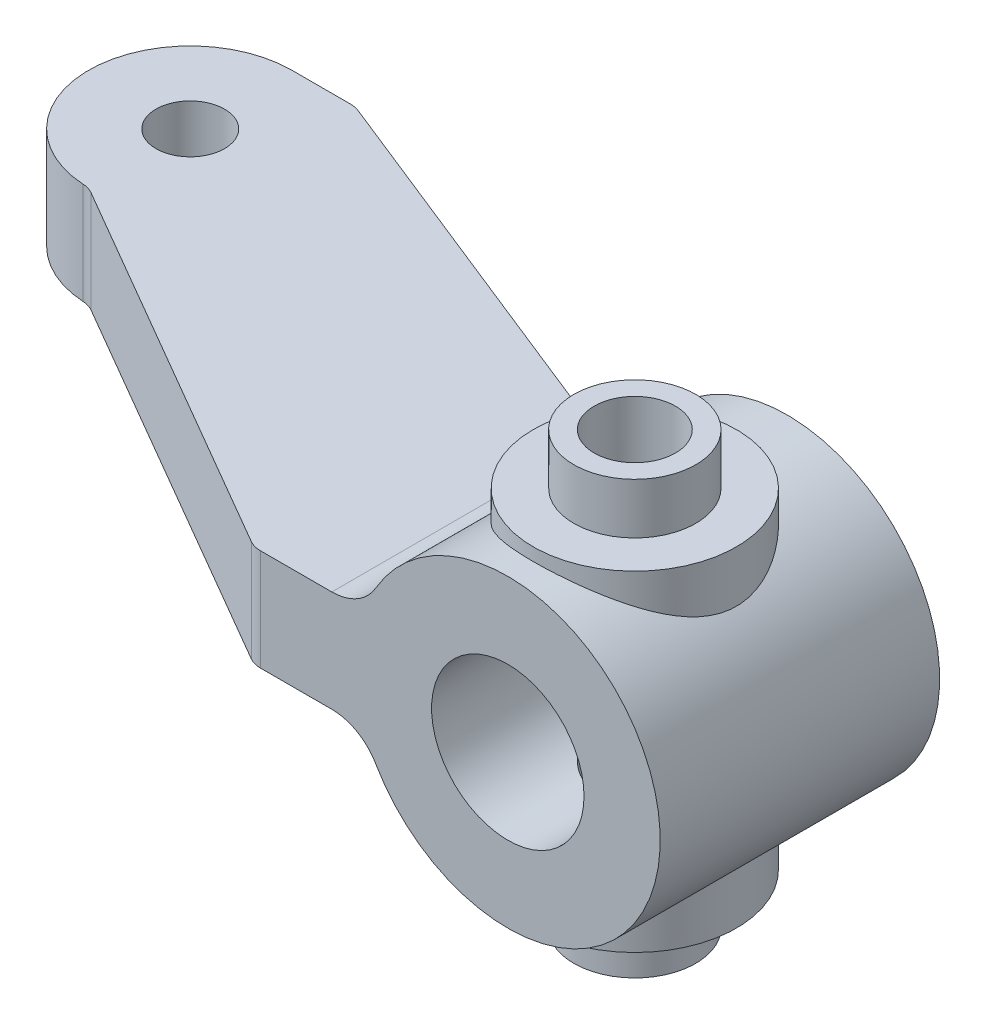
from build123d import *

# Parameters (mm, degrees)
BOSS_EXTRUDE1_DEPTH            = 5
BOSS_EXTRUDE1_DEPTH_BACK       = 6
SKETCH2_R                      = 6
CUT_EXTRUDE1_REACH             = 14.01
SKETCH3_R                      = 3
CUT_EXTRUDE1_DIRECTION_2_REACH = 14.01
SKETCH4_R                      = 1.6
CUT_EXTRUDE4_DEPTH             = 17
BOSS_EXTRUDE2_DEPTH            = 2
BOSS_EXTRUDE2_DEPTH_BACK       = 2
SKETCH5_R                      = 1.35
FILLET1_R                      = 2
FILLET2_R                      = 1


with BuildPart() as part:
    # Sketch1 → Revolve1 (revolve)
    with BuildSketch(Plane.XY, mode=Mode.PRIVATE) as revolve1_sk:
        Polygon((1.6, -8.5), (1.6, 8.5), (2.4, 8.5), (2.4, 6.5), (4, 6.5), (4, -6.5), (2.4, -6.5), (2.4, -8.5), align=None)
    revolve(revolve1_sk.sketch.rotate(Axis((0, 9.772747413, 0), (0, -1, 0)), 180), axis=Axis((0, 9.772747413, 0), (0, -1, 0)))

    # Sketch2 → Boss-Extrude1 (add, two sides: drawn at the far end of the back side and taken through both)
    with BuildSketch(Plane.XY.offset(-BOSS_EXTRUDE1_DEPTH_BACK)):
        Circle(SKETCH2_R)
    extrude(amount=BOSS_EXTRUDE1_DEPTH + BOSS_EXTRUDE1_DEPTH_BACK)

    # Sketch3 → Cut-Extrude1 (cut, up to next)
    with BuildSketch(Plane.XY, mode=Mode.PRIVATE) as cut_extrude1_sk1:
        Circle(SKETCH3_R)
    cut_extrude1_tool1 = extrude(cut_extrude1_sk1.sketch, amount=-CUT_EXTRUDE1_REACH, mode=Mode.PRIVATE) & part.part
    add(cut_extrude1_tool1.solids().sort_by_distance((0, 0, 0))[0], mode=Mode.SUBTRACT)

    # Sketch3 → Cut-Extrude1 direction 2 (cut, up to next)
    with BuildSketch(Plane.XY, mode=Mode.PRIVATE) as cut_extrude1_direction_2_sk1:
        Circle(SKETCH3_R)
    cut_extrude1_direction_2_tool1 = extrude(cut_extrude1_direction_2_sk1.sketch, amount=CUT_EXTRUDE1_DIRECTION_2_REACH, mode=Mode.PRIVATE) & part.part
    add(cut_extrude1_direction_2_tool1.solids().sort_by_distance((0, 0, 0))[0], mode=Mode.SUBTRACT)

    # Sketch4 → Cut-Extrude4 (cut)
    with BuildSketch(Plane(origin=(0, 8.5, 0), x_dir=(1, 0, 0), z_dir=(0, 1, 0))):
        with Locations(Location((0, 0, 0), (0, 0, 180))):
            Circle(SKETCH4_R)
    extrude(amount=-CUT_EXTRUDE4_DEPTH, mode=Mode.SUBTRACT)

    # Sketch5 → Boss-Extrude2 (add, two sides: drawn at the far end of the back side and taken through both)
    with BuildSketch(Plane(origin=(0, 0, 0), x_dir=(1, 0, 0), z_dir=(0, 1, 0)).offset(-BOSS_EXTRUDE2_DEPTH_BACK)):
        with BuildLine():
            Line((-6, -5), (-10, -5))
            Line((-10, -5), (-25.5, 4))
            ThreePointArc((-25.5, 4), (-29.5, 8), (-25.5, 12))
            Line((-25.5, 12), (-23, 12))
            Line((-23, 12), (-8, 6))
            Line((-8, 6), (-6, 6))
            Line((-6, 6), (-3, 6))
            Line((-3, 6), (-3, -5))
            Line((-3, -5), (-6, -5))
        make_face()
        with Locations(Location((-25.5, 8, 0), (0, 0, 270))):
            Circle(SKETCH5_R, mode=Mode.SUBTRACT)
    extrude(amount=BOSS_EXTRUDE2_DEPTH + BOSS_EXTRUDE2_DEPTH_BACK)

    # Fillet1
    fillet1_edges = [part.edges().sort_by_distance(p)[0] for p in [
        (-5.656854249, 2, -0.5),
        (-5.656854249, -2, -0.5),
    ]]
    fillet(fillet1_edges, radius=FILLET1_R)

    # Fillet2
    fillet2_edges = [part.edges().sort_by_distance(p)[0] for p in [
        (-10, 0, 5),
        (-25.5, 0, -4),
        (-23, 0, -12),
        (-8, 0, -6),
    ]]
    fillet(fillet2_edges, radius=FILLET2_R)


solid = part.part
